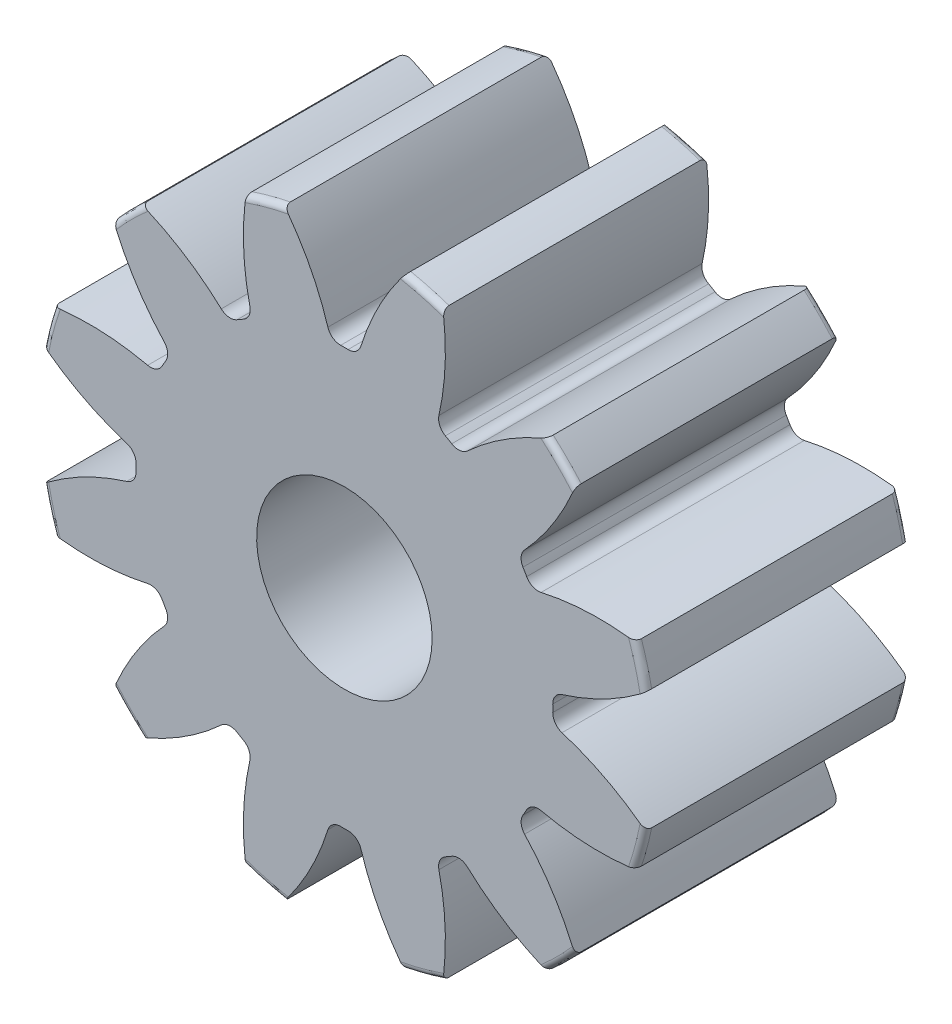
from build123d import *

# Parameters (mm, degrees)
FILLET2_R          = 0.07
CUT_EXTRUDE2_DEPTH = 7.363961141
CIRPATTERN1_COUNT  = 12
SKETCH9_R          = 3.5
CUT_EXTRUDE3_DEPTH = 7.289675634


with BuildPart() as part:
    # Sketch4 → Revolve1 (revolve)
    with BuildSketch(Plane(origin=(0, 0, 0), x_dir=(0, 0, -1), z_dir=(1, 0, 0))):
        Polygon((-7, 1), (-7, 2.25), (-3, 2.25), (-3, 3.5), (0, 3.5), (0, 1), align=None)
    revolve(axis=Axis((0, 0, 3), (0, 0, 1)))

    # Fillet2
    fillet2_edges = [part.edges().sort_by_distance(p)[0] for p in [
        (0, -3.5, 0),
        (0, -3.5, 3),
        (0, -2.25, 3),
        (0, -2.25, 7),
    ]]
    fillet(fillet2_edges, radius=FILLET2_R)

    # Sketch7 → Cut-Extrude2 (cut, through all)
    with BuildSketch(Plane.XY.offset(3)):
        with BuildLine():
            ThreePointArc((-0.042070551, 2.374627354), (0, 2.375), (0.042070551, 2.374627354))
            ThreePointArc((0.042070551, 2.374627354), (0.13259254, 2.40302909), (0.187970292, 2.480062809))
            ThreePointArc((0.187970292, 2.480062809), (0.393796454, 2.978587459), (0.685558819, 3.432201787))
            ThreePointArc((0.685558819, 3.432201787), (0, 3.5), (-0.685558819, 3.432201787))
            ThreePointArc((-0.685558819, 3.432201787), (-0.393796454, 2.978587459), (-0.187970292, 2.480062809))
            ThreePointArc((-0.187970292, 2.480062809), (-0.13259254, 2.40302909), (-0.042070551, 2.374627354))
        make_face()
    cut_extrude2 = extrude(amount=-CUT_EXTRUDE2_DEPTH, mode=Mode.SUBTRACT)

    # CirPattern1: Cut-Extrude2 ×12 about axis
    cirpattern1_axis = Axis((0, 0, 0), (0, 0, 1))
    for i in range(1, CIRPATTERN1_COUNT):
        add(cut_extrude2.rotate(cirpattern1_axis, i * 360 / CIRPATTERN1_COUNT), mode=Mode.SUBTRACT)

    # Sketch9 → Cut-Extrude3 (cut, through all)
    with BuildSketch(Plane.XY.offset(3)):
        Circle(SKETCH9_R)
    extrude(amount=CUT_EXTRUDE3_DEPTH, mode=Mode.SUBTRACT)


solid = part.part
